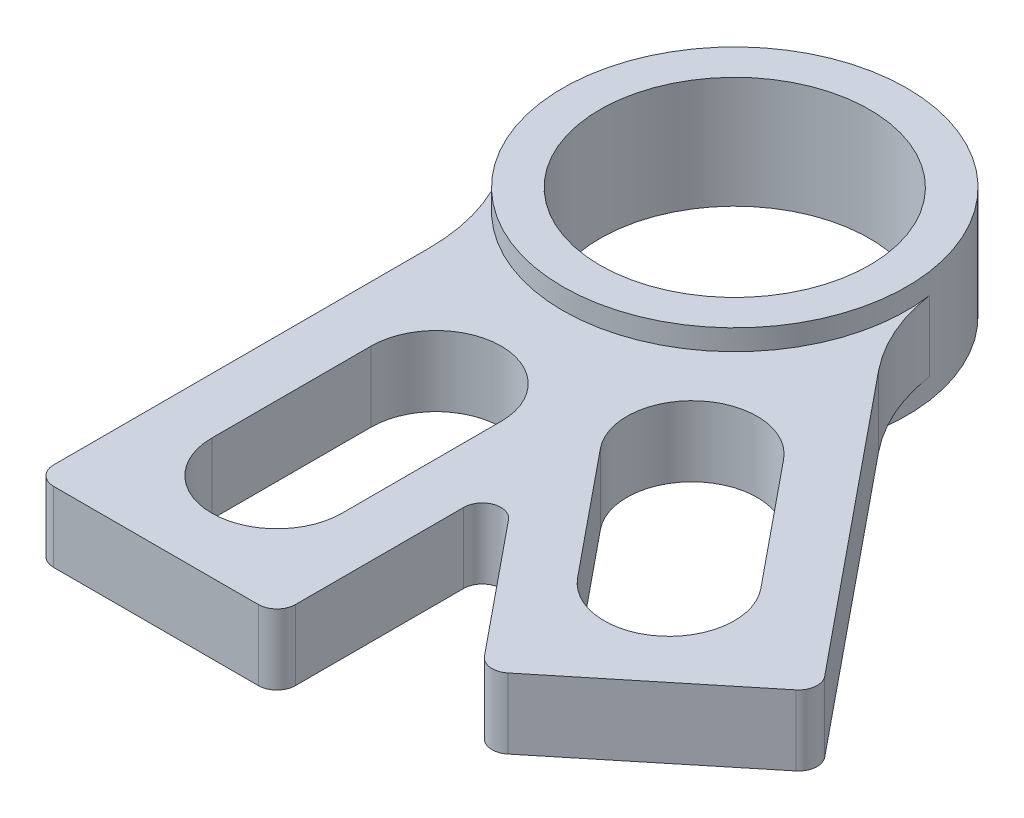
from build123d import *

# Parameters (mm, degrees)
BOSS_EXTRUDE1_DEPTH      = 4.7625
BOSS_EXTRUDE1_DEPTH_BACK = 4.7625
SKETCH1_R                = 14.6812
SKETCH1_R_2              = 11.5062
BOSS_EXTRUDE2_DEPTH      = 2.9972
BOSS_EXTRUDE2_DEPTH_BACK = 2.9972
FILLET1_R                = 16.002
FILLET2_R                = 1.5875


with BuildPart() as part:
    # Sketch1 → Boss-Extrude1 (new, two sides: drawn at the far end of the back side and taken through both)
    with BuildSketch(Plane(origin=(0, 0, 0), x_dir=(1, 0, 0), z_dir=(0, 1, 0)).offset(-BOSS_EXTRUDE1_DEPTH_BACK)):
        with Locations(Location((0, 0, 0), (0, 0, 270))):
            Circle(SKETCH1_R)
        with Locations(Location((0, 0, 0), (0, 0, 270))):
            Circle(SKETCH1_R_2, mode=Mode.SUBTRACT)
    extrude(amount=BOSS_EXTRUDE1_DEPTH + BOSS_EXTRUDE1_DEPTH_BACK)

    # Sketch1<4> → Boss-Extrude2 (add, two sides: drawn at the far end of the back side and taken through both)
    with BuildSketch(Plane(origin=(0, 0, 0), x_dir=(1, 0, 0), z_dir=(0, 1, 0)).offset(-BOSS_EXTRUDE2_DEPTH_BACK)):
        with BuildLine():
            Line((-10.31875, -10.443228997), (-10.31875, -49.3903))
            Line((-10.31875, -49.3903), (10.31875, -49.3903))
            Line((10.31875, -49.3903), (10.31875, -28.986981317))
            Line((10.31875, -28.986981317), (23.211292264, -44.800828643))
            Line((23.211292264, -44.800828643), (39.206644749, -31.760310817))
            Line((39.206644749, -31.760310817), (14.596591512, -1.573896333))
            ThreePointArc((14.596591512, -1.573896333), (4.923540137, -13.830993672), (-10.31875, -10.443228997))
        make_face()
        with BuildLine():
            Line((-5.55625, -39.07155), (-5.55625, -25.48255))
            ThreePointArc((-5.55625, -25.48255), (0, -19.9263), (5.55625, -25.48255))
            Line((5.55625, -25.48255), (5.55625, -39.07155))
            ThreePointArc((5.55625, -39.07155), (0, -44.6278), (-5.55625, -39.07155))
        make_face(mode=Mode.SUBTRACT)
        with BuildLine():
            Line((20.38226854, -33.793802133), (11.795589111, -23.261477728))
            ThreePointArc((11.795589111, -23.261477728), (12.591121519, -15.444128029), (20.408471218, -16.239660438))
            Line((20.408471218, -16.239660438), (28.995150647, -26.771984843))
            ThreePointArc((28.995150647, -26.771984843), (28.199618239, -34.589334541), (20.38226854, -33.793802133))
        make_face(mode=Mode.SUBTRACT)
    extrude(amount=BOSS_EXTRUDE2_DEPTH + BOSS_EXTRUDE2_DEPTH_BACK)

    # Fillet1
    fillet1_edges = [part.edges().sort_by_distance(p)[0] for p in [
        (-10.31875, 0, 10.443228997),
        (14.596591512, 0, 1.573896333),
    ]]
    fillet(fillet1_edges, radius=FILLET1_R)

    # Fillet2
    fillet2_edges = [part.edges().sort_by_distance(p)[0] for p in [
        (39.206644749, 0, 31.760310817),
        (23.211292264, 0, 44.800828643),
        (10.31875, 0, 28.986981317),
        (10.31875, 0, 49.3903),
        (-10.31875, 0, 49.3903),
    ]]
    fillet(fillet2_edges, radius=FILLET2_R)


solid = part.part
